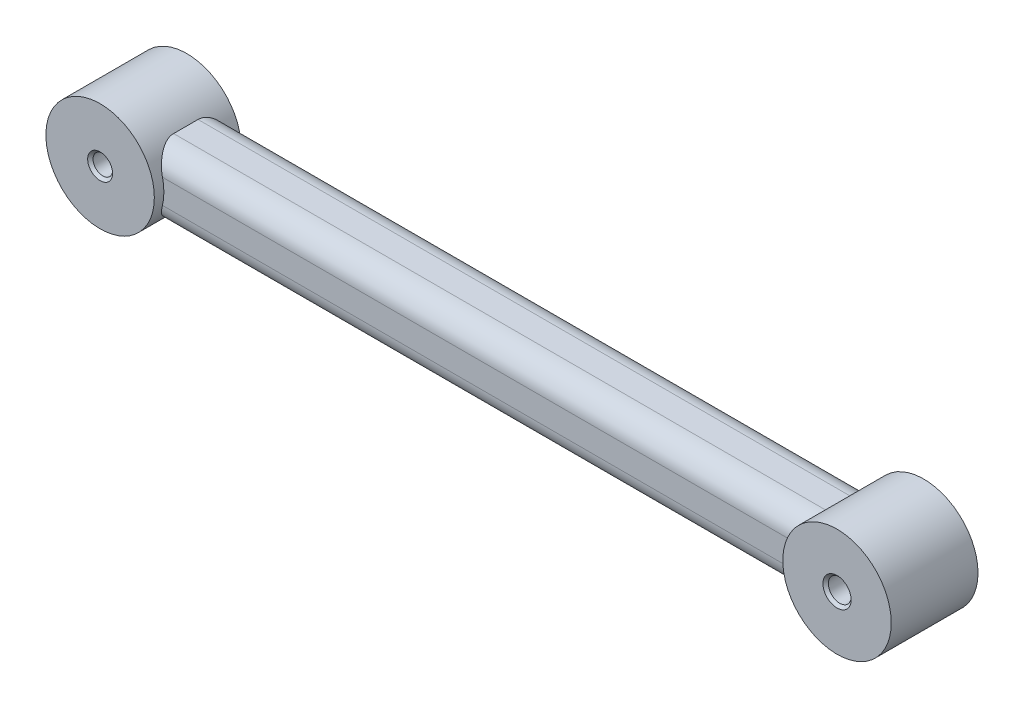
from build123d import *

# Parameters (mm, degrees)
SKETCH_1_R                       = 2
SKETCH_1_R_2                     = 0.36
EXTRUDE_1_DEPTH                  = 1.6
SKETCH_1_R_3                     = 0.42
EXTRUDE_1_2_DEPTH                = 1.6
EXTRUDE_2_REACH                  = 28.306
EXTRUDE_2_END_RADIUS             = 2
SKETCH_2_W                       = 2.5
SKETCH_2_H                       = 2.5
EXTRUDE_2_DIRECTION_2_REACH      = 28.306
EXTRUDE_2_DIRECTION_2_END_RADIUS = 2
CHAMFER_1_SIZE                   = 0.1
FILLET_1_R                       = 0.8


with BuildPart() as part:
    # 草图1 → 凸台-拉伸1 (new, symmetric)
    with BuildSketch(Plane.XY):
        Circle(SKETCH_1_R)
        Circle(SKETCH_1_R_2, mode=Mode.SUBTRACT)
    extrude(amount=EXTRUDE_1_DEPTH, both=True)



with BuildPart() as body_2:
    # 草图1 → Extrude 1 2 (new, symmetric)
    with BuildSketch(Plane.XY):
        with Locations((27.180718048, 0)):
            Circle(SKETCH_1_R)
        with Locations((27.180718048, 0)):
            Circle(SKETCH_1_R_3, mode=Mode.SUBTRACT)
    extrude(amount=EXTRUDE_1_2_DEPTH, both=True)


with BuildPart() as part_1:
    add(part.part)

    add(body_2.part)  # 凸台-拉伸2 merges body 2
    # 凸台-拉伸2: up to this cylinder (the profile starts outside it)
    extrude_2_end = Plane(origin=(27.180718048, 0, 0), z_dir=(0, 0, -1)) * Cylinder(EXTRUDE_2_END_RADIUS, 61.612, mode=Mode.PRIVATE)
    # 草图2 → 凸台-拉伸2 (add, up to the surface)
    with BuildSketch(Plane(origin=(3, 0, 0), x_dir=(0, 0, -1), z_dir=(1, 0, 0)), mode=Mode.PRIVATE) as extrude_2_sk1:
        Rectangle(SKETCH_2_W, SKETCH_2_H)
    extrude_2_tool1 = extrude(extrude_2_sk1.sketch, amount=EXTRUDE_2_REACH, mode=Mode.PRIVATE) - extrude_2_end
    add(extrude_2_tool1.solids().sort_by_distance((3, 0, 0))[0])

    # 凸台-拉伸2 direction 2: up to this cylinder (the profile starts outside it)
    extrude_2_direction_2_end = Plane(origin=(0, 0, 0), z_dir=(0, 0, -1)) * Cylinder(EXTRUDE_2_DIRECTION_2_END_RADIUS, 61.612, mode=Mode.PRIVATE)
    # 草图2 → 凸台-拉伸2 direction 2 (add, up to the surface)
    with BuildSketch(Plane(origin=(3, 0, 0), x_dir=(0, 0, -1), z_dir=(1, 0, 0)), mode=Mode.PRIVATE) as extrude_2_direction_2_sk1:
        Rectangle(SKETCH_2_W, SKETCH_2_H)
    extrude_2_direction_2_tool1 = extrude(extrude_2_direction_2_sk1.sketch, amount=-EXTRUDE_2_DIRECTION_2_REACH, mode=Mode.PRIVATE) - extrude_2_direction_2_end
    add(extrude_2_direction_2_tool1.solids().sort_by_distance((3, 0, 0))[0])

    # 倒角1
    chamfer_1_edges = [part_1.edges().sort_by_distance(p)[0] for p in [
        (26.760718048, 0, 1.6),
        (26.760718048, 0, -1.6),
        (-0.36, 0, 1.6),
        (-0.36, 0, -1.6),
    ]]
    chamfer(chamfer_1_edges, length=CHAMFER_1_SIZE)

    # 圆角1
    fillet_1_edges = [part_1.edges().sort_by_distance(p)[0] for p in [
        (13.590359024, -1.25, 1.25),
        (13.590359024, -1.25, -1.25),
        (13.590359024, 1.25, 1.25),
        (13.590359024, 1.25, -1.25),
    ]]
    fillet(fillet_1_edges, radius=FILLET_1_R)


solid = part_1.part
